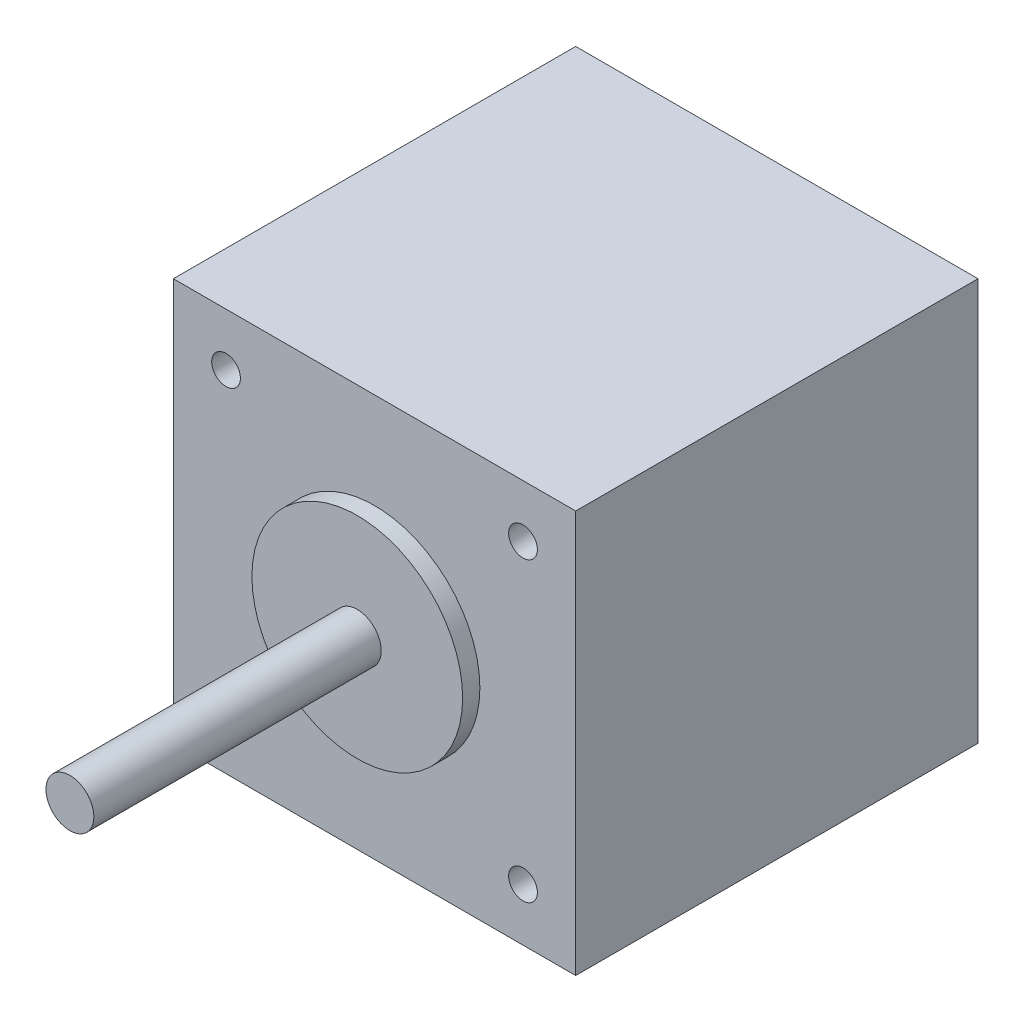
from build123d import *

# Parameters (mm, degrees)
SKETCH_1_W          = 42
SKETCH_1_H          = 42
EXTRUDE_1_DEPTH     = 42
SKETCH_2_R          = 1.5
CUT_EXTRUDE_1_DEPTH = 10
SKETCH_3_R          = 11
EXTRUDE_2_DEPTH     = 1.8
SKETCH_4_R          = 2.5
EXTRUDE_3_DEPTH     = 30


with BuildPart() as part:
    # 草图1 → 凸台-拉伸1 (new body)
    with BuildSketch(Plane.XY):
        Rectangle(SKETCH_1_W, SKETCH_1_H)
    extrude(amount=EXTRUDE_1_DEPTH)

    # 草图2 → 切除-拉伸1 (cut)
    with BuildSketch(Plane.XY.offset(42)):
        with Locations((15.5, 15.5)):
            Circle(SKETCH_2_R)
        with Locations(Location((-15.5, 15.5, 0), (0, 0, 180))):
            Circle(SKETCH_2_R)
        with Locations((-15.5, -15.5)):
            Circle(SKETCH_2_R)
        with Locations(Location((15.5, -15.5, 0), (0, 0, 180))):
            Circle(SKETCH_2_R)
    extrude(amount=-CUT_EXTRUDE_1_DEPTH, mode=Mode.SUBTRACT)

    # 草图3 → 凸台-拉伸2 (add)
    with BuildSketch(Plane.XY.offset(42)):
        Circle(SKETCH_3_R)
    extrude(amount=EXTRUDE_2_DEPTH)

    # 草图4 → 凸台-拉伸3 (add)
    with BuildSketch(Plane.XY.offset(43.8)):
        Circle(SKETCH_4_R)
    extrude(amount=EXTRUDE_3_DEPTH)


solid = part.part
